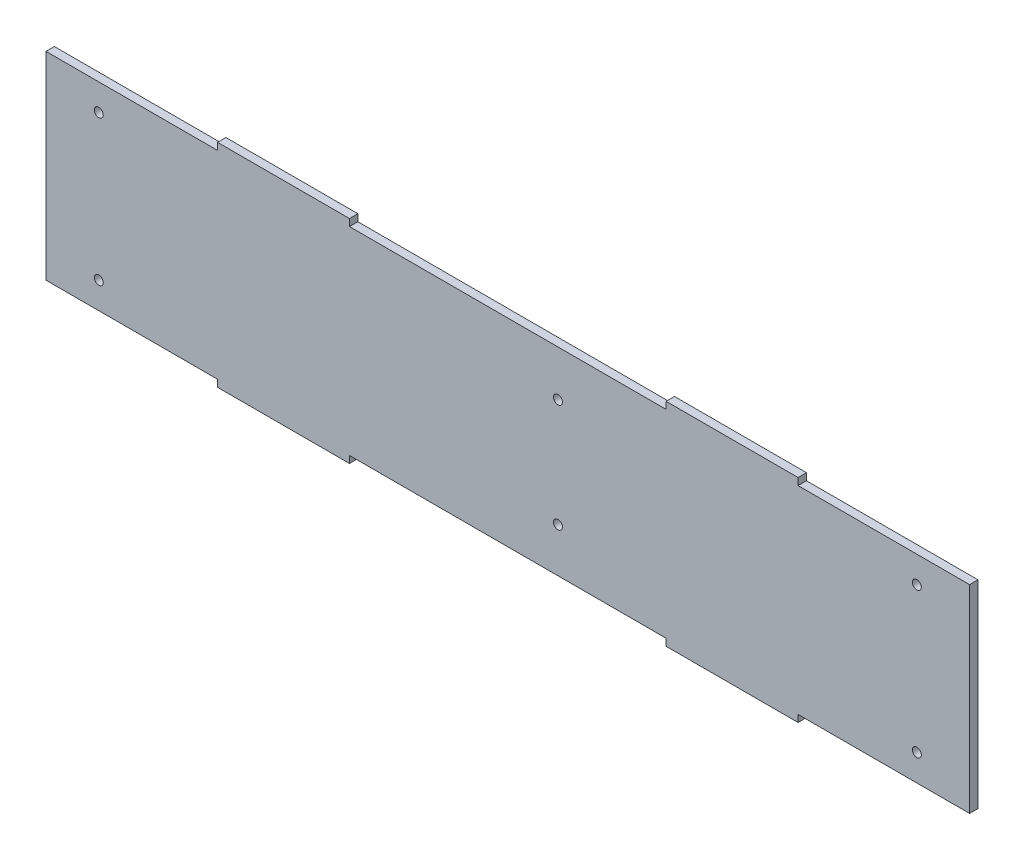
from build123d import *

# Parameters (mm, degrees)
SKETCH2_R           = 1.7
BOSS_EXTRUDE1_DEPTH = 3.175


with BuildPart() as part:
    # Sketch2 → Boss-Extrude1 (new body)
    with BuildSketch(Plane.XY):
        Polygon((0, 0), (65, 0), (65, -2.65), (115, -2.65), (115, 0), (235, 0), (235, -2.65), (285, -2.65), (285, 0), (350, 0), (350, 75.1), (285, 75.1), (285, 77.75), (235, 77.75), (235, 75.1), (115, 75.1), (115, 77.75), (65, 77.75), (65, 75.1), (0, 75.1), align=None)
        with Locations((20, 10.05)):
            Circle(SKETCH2_R, mode=Mode.SUBTRACT)
        with Locations((330, 10.05)):
            Circle(SKETCH2_R, mode=Mode.SUBTRACT)
        with Locations((330, 65.05)):
            Circle(SKETCH2_R, mode=Mode.SUBTRACT)
        with Locations((20, 65.05)):
            Circle(SKETCH2_R, mode=Mode.SUBTRACT)
        with Locations((194, 16.8)):
            Circle(SKETCH2_R, mode=Mode.SUBTRACT)
        with Locations((194, 57.8)):
            Circle(SKETCH2_R, mode=Mode.SUBTRACT)
    extrude(amount=BOSS_EXTRUDE1_DEPTH)


solid = part.part
